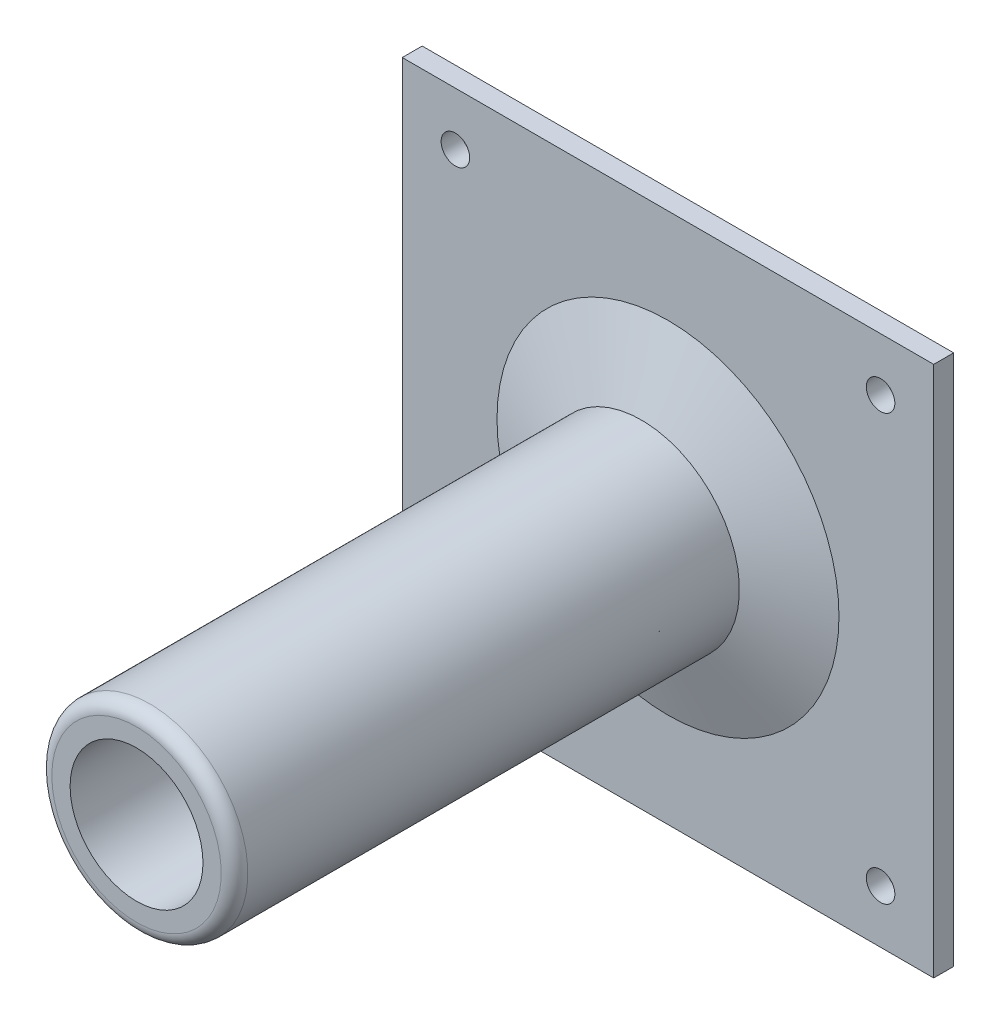
from build123d import *

# Parameters (mm, degrees)
ESQUISSE1_W                  = 80
ESQUISSE1_H                  = 80
BOSS_EXTRU_1_DEPTH           = 3
BOSS_EXTRU_2_START           = 3
ESQUISSE2_R                  = 14.75
BOSS_EXTRU_2_DEPTH           = 80
CONG_1_R                     = 2
CHANFREIN1_SIZE              = 4
CHANFREIN1_SIZE2             = 10.989909678
ENL_V_MAT_EXTRU_1_DEPTH      = 101.444014257
ENL_V_MAT_EXTRU_1_DEPTH_BACK = 101.444014257
ESQUISSE3_R                  = 10
CONG_2_R                     = 5
D_GAGEMENT_M43_D             = 4.3
SYM_TRIE2_COPY_1_D           = 4.3


with BuildPart() as part:
    # Esquisse1 → Boss.-Extru.1 (new body)
    with BuildSketch(Plane.XY):
        Rectangle(ESQUISSE1_W, ESQUISSE1_H)
    extrude(amount=BOSS_EXTRU_1_DEPTH)

    # Esquisse2 → Boss.-Extru.2 (add)
    with BuildSketch(Plane.XY.offset(BOSS_EXTRU_2_START)):
        with Locations(Location((0, 0, 0), (0, 0, 180))):
            Circle(ESQUISSE2_R)
    extrude(amount=BOSS_EXTRU_2_DEPTH)

    # Congé1
    cong_1_edges = [part.edges().sort_by_distance(p)[0] for p in [
        (14.75, 0, 83),
    ]]
    fillet(cong_1_edges, radius=CONG_1_R)

    # Chanfrein1
    chanfrein1_edges = [part.edges().sort_by_distance(p)[0] for p in [
        (14.75, 0, 3),
    ]]
    chanfrein1_side = [part.faces().sort_by_distance(p)[0] for p in [
        (14.75, 0, 42),
    ]]
    chamfer(chanfrein1_edges, length=CHANFREIN1_SIZE, length2=CHANFREIN1_SIZE2, reference=chanfrein1_side[0])

    # Esquisse3 → Enlèv. mat.-Extru.1 (cut, two sides: drawn at the far end of the back side and taken through both)
    with BuildSketch(Plane.XY.offset(-ENL_V_MAT_EXTRU_1_DEPTH_BACK)):
        with Locations(Location((0, 0, 0), (0, 0, 180))):
            Circle(ESQUISSE3_R)
    extrude(amount=ENL_V_MAT_EXTRU_1_DEPTH + ENL_V_MAT_EXTRU_1_DEPTH_BACK, mode=Mode.SUBTRACT)

    # Congé2
    cong_2_edges = [part.edges().sort_by_distance(p)[0] for p in [
        (10, 0, 0),
    ]]
    fillet(cong_2_edges, radius=CONG_2_R)

    # Dégagement M43 (through all)
    with Locations(Plane(origin=(3.971676253, 8.06271861, 3), x_dir=(1, 0, 0), z_dir=(0, 0, 1))):
        with Locations((28.028323747, -40.06271861)):
            d_gagement_m43 = Hole(D_GAGEMENT_M43_D / 2)

    # Symétrie1: Dégagement M43 across plane
    add(d_gagement_m43.mirror(Plane.ZX), mode=Mode.SUBTRACT)

    # Symétrie2: Dégagement M43 across plane
    add(d_gagement_m43.mirror(Plane(origin=(0, 0, 0), x_dir=(0, 0, 1), z_dir=(1, 0, 0))), mode=Mode.SUBTRACT)

    # Symétrie2 copy 1 (through all)
    with Locations(Plane(origin=(-3.971676253, -8.06271861, 3), x_dir=(-1, 0, 0), z_dir=(0, 0, 1))):
        with Locations((28.028323747, -40.06271861)):
            Hole(SYM_TRIE2_COPY_1_D / 2)


solid = part.part
